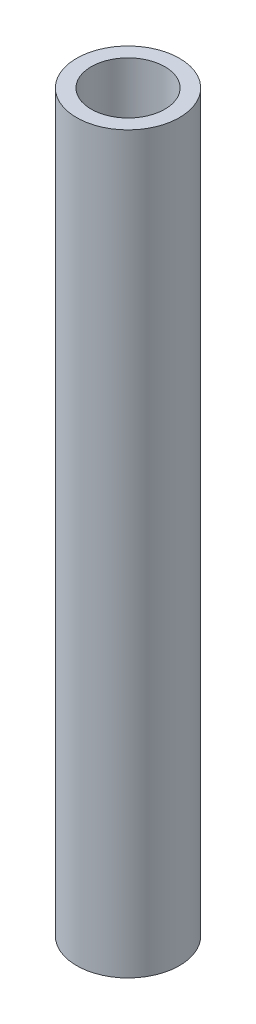
from build123d import *

# Parameters (mm, degrees)
SKETCH1_R           = 10.668
SKETCH1_R_2         = 7.6454
BOSS_EXTRUDE1_DEPTH = 152.4


with BuildPart() as part:
    # Sketch1 → Boss-Extrude1 (new body)
    with BuildSketch(Plane(origin=(0, 0, 0), x_dir=(1, 0, 0), z_dir=(0, 1, 0))):
        with Locations(Location((0, 0, 0), (0, 0, 90))):
            Circle(SKETCH1_R)
        with Locations(Location((0, 0, 0), (0, 0, 90))):
            Circle(SKETCH1_R_2, mode=Mode.SUBTRACT)
    extrude(amount=BOSS_EXTRUDE1_DEPTH)


solid = part.part
